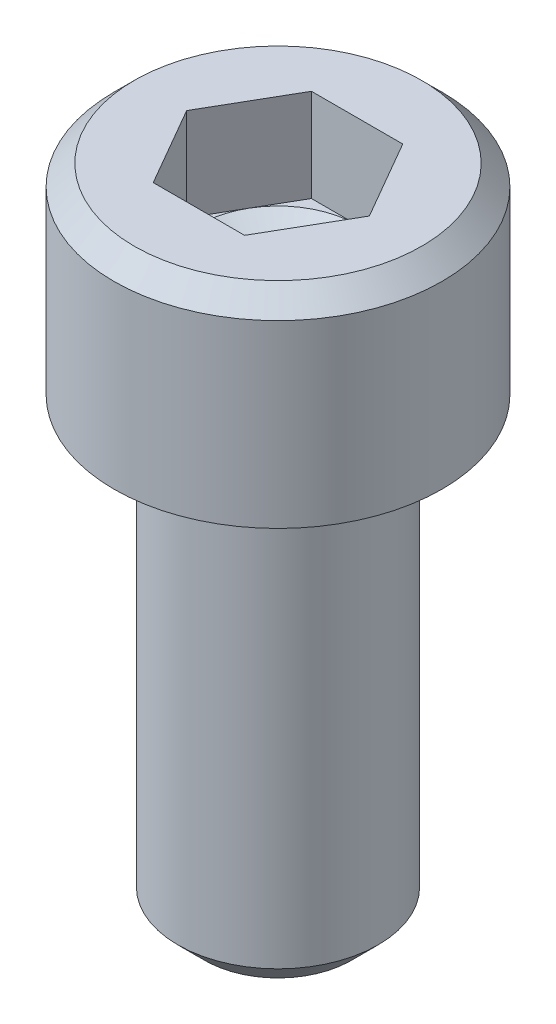
from build123d import *

# Parameters (mm, degrees)
SKETCH1_W           = 2.8702
SKETCH1_H           = 3.5052
SKETCH2_R           = 1.7526
BOSS_EXTRUDE1_DEPTH = 7.9375
CUT_EXTRUDE1_DEPTH  = 1.6256
CHAMFER1_SIZE       = 0.47244
CHAMFER2_SIZE       = 0.3556
FILLET1_R           = 0.254


with BuildPart() as part:
    # Sketch1 → Revolve1 (revolve)
    with BuildSketch(Plane.XY, mode=Mode.PRIVATE) as revolve1_sk:
        with Locations((1.4351, 1.7526)):
            Rectangle(SKETCH1_W, SKETCH1_H)
    revolve(revolve1_sk.sketch.rotate(Axis((0, 3.5052, 0), (0, -1, 0)), 270), axis=Axis((0, 3.5052, 0), (0, -1, 0)))

    # Sketch2 → Boss-Extrude1 (add)
    with BuildSketch(Plane.XZ):
        with Locations(Location((0, 0, 0), (0, 0, 270))):
            Circle(SKETCH2_R)
    extrude(amount=BOSS_EXTRUDE1_DEPTH)

    # Sketch3 → Cut-Extrude1 (cut)
    with BuildSketch(Plane(origin=(0, 3.5052, 0), x_dir=(-1, 0, 0), z_dir=(0, 1, 0))):
        Polygon((-0.799225978, 1.3843), (-1.598451955, 0), (-0.799225978, -1.3843), (0.799225978, -1.3843), (1.598451955, 0), (0.799225978, 1.3843), align=None)
    extrude(amount=-CUT_EXTRUDE1_DEPTH, mode=Mode.SUBTRACT)

    # Sketch4 → Cut-Revolve1 (revolve, cut)
    with BuildSketch(Plane.XY, mode=Mode.PRIVATE) as cut_revolve1_sk:
        Polygon((1.3843, 1.8796), (0, 1.8796), (0, 1.080374022), align=None)
    revolve(cut_revolve1_sk.sketch.rotate(Axis((0, 1.879625, 0), (0, -1, 0)), 180), axis=Axis((0, 1.879625, 0), (0, -1, 0)), mode=Mode.SUBTRACT)

    # Chamfer1
    chamfer1_edges = [part.edges().sort_by_distance(p)[0] for p in [
        (0, -7.9375, 1.7526),
    ]]
    chamfer(chamfer1_edges, length=CHAMFER1_SIZE)

    # Chamfer2
    chamfer2_edges = [part.edges().sort_by_distance(p)[0] for p in [
        (0, 3.5052, 2.8702),
    ]]
    chamfer(chamfer2_edges, length=CHAMFER2_SIZE)

    # Fillet1
    fillet1_edges = [part.edges().sort_by_distance(p)[0] for p in [
        (0, 0, 1.7526),
    ]]
    fillet(fillet1_edges, radius=FILLET1_R)


solid = part.part
